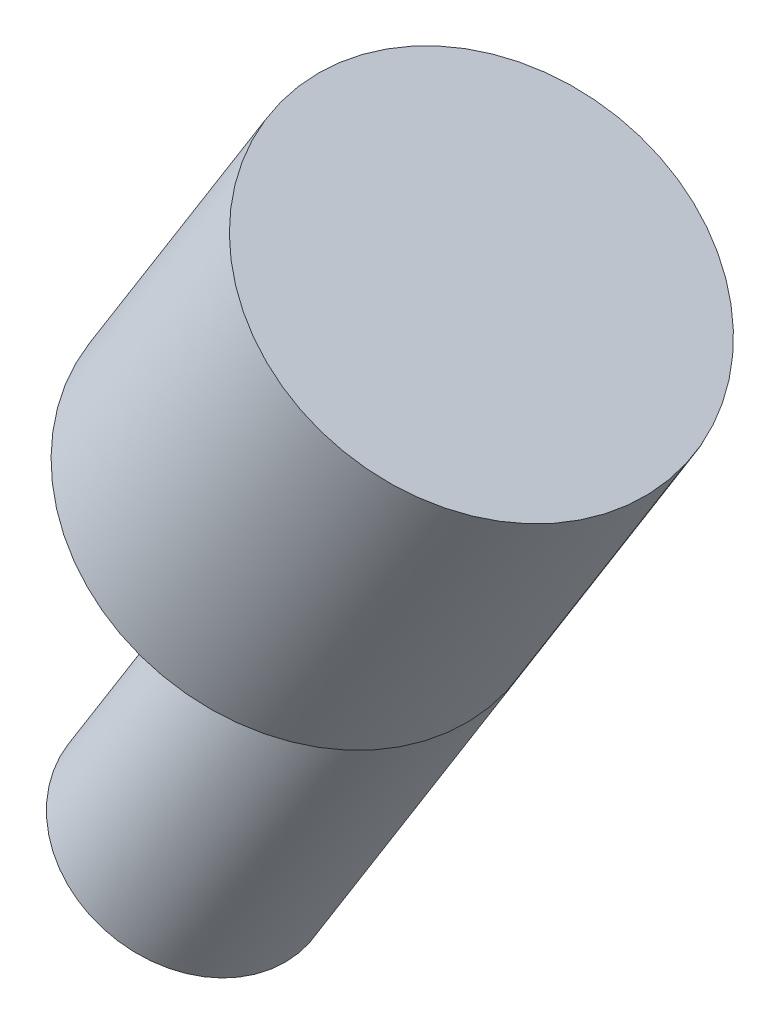
from build123d import *

# Parameters (mm, degrees)
ESQUISSE1_R        = 2.3
BOSS_EXTRU_1_DEPTH = 15
ESQUISSE2_R        = 4
BOSS_EXTRU_2_DEPTH = 7


with BuildPart() as part:
    # Esquisse1 → Boss.-Extru.1 (new body)
    with BuildSketch(Plane(origin=(0.807648755, 1.292238009, 0), x_dir=(0.8479983040028684, -0.5299989400067315, 0), z_dir=(-0.5299989400067315, -0.8479983040028684, 0))):
        with Locations((-28.819321466, -165)):
            Circle(ESQUISSE1_R)
    extrude(amount=-BOSS_EXTRU_1_DEPTH)

    # Esquisse2 → Boss.-Extru.2 (add)
    with BuildSketch(Plane(origin=(8.757632855, 14.012212569, 0), x_dir=(0.8479983040028682, -0.5299989400067318, 0), z_dir=(0.5299989400067318, 0.8479983040028682, 0))):
        with Locations(Location((-28.819321466, 159.375, 0), (0, 0, 70.241351879))):
            Circle(ESQUISSE2_R)
    extrude(amount=BOSS_EXTRU_2_DEPTH)


solid = part.part
